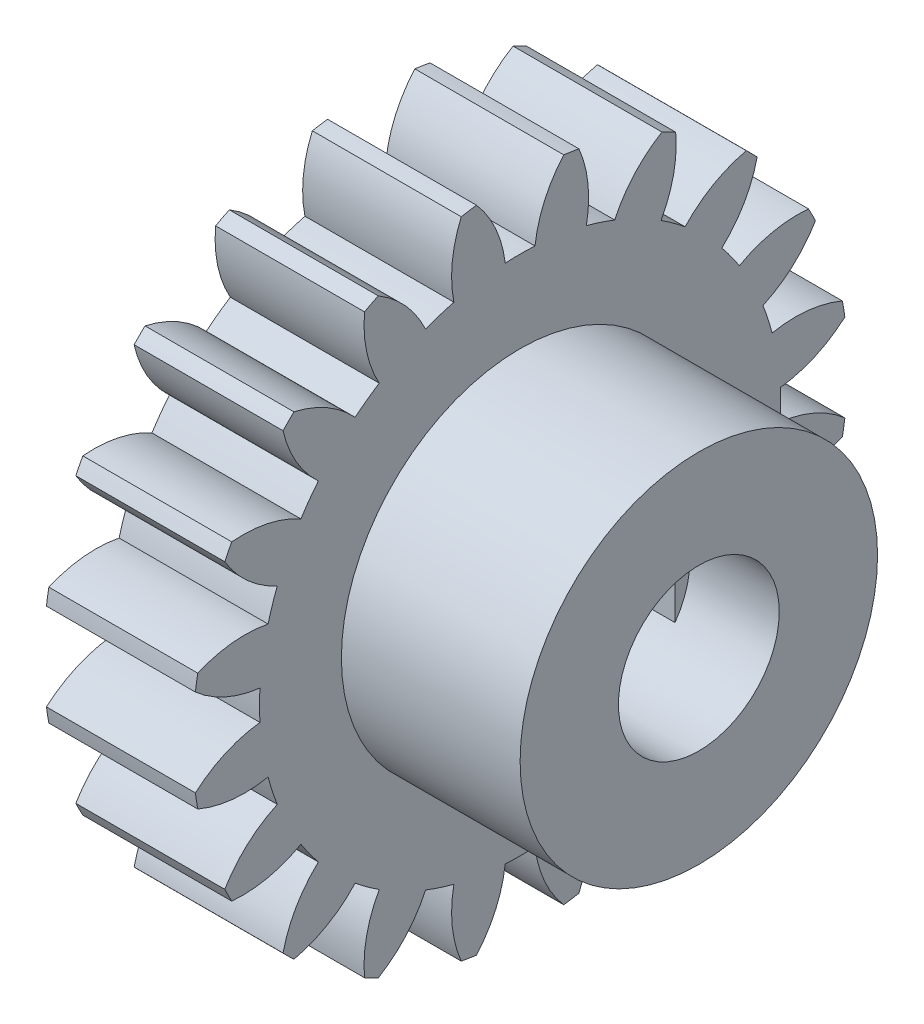
from build123d import *

# Parameters (mm, degrees)
BASPROSKE_W         = 5
BASPROSKE_H         = 11
TOOTHCUT_DEPTH      = 17.340134638
TEETHCUTS_COUNT     = 20
BORSKE_R            = 1.5
BORE_DEPTH          = 50.0000508
SKETCH_1_R          = 6
EXTRUDE_1_DEPTH     = 6
CUT_EXTRUDE_1_DEPTH = 14
SKETCH_3_R          = 2.7
CUT_EXTRUDE_2_DEPTH = 3


with BuildPart() as part:
    # BasProSke → Base-Revolve (revolve)
    with BuildSketch(Plane(origin=(0, 0, 0), x_dir=(1, 0, 0), z_dir=(0, 1, 0)), mode=Mode.PRIVATE) as base_revolve_sk:
        with Locations((2.5, 5.5)):
            Rectangle(BASPROSKE_W, BASPROSKE_H)
    revolve(base_revolve_sk.sketch.rotate(Axis((-10, 0, 0), (1, 0, 0)), 180), axis=Axis((-10, 0, 0), (1, 0, 0)))

    # TooCutSke → ToothCut (cut, through all)
    with BuildSketch(Plane(origin=(0, 0, 0), x_dir=(0, 0, -1), z_dir=(1, 0, 0))):
        with BuildLine():
            ThreePointArc((0.499924007, 8.734705318), (0, 8.749), (-0.499924007, 8.734705318))
            ThreePointArc((-0.499924007, 8.734705318), (-0.824302243, 9.905497836), (-1.485192705, 10.924909509))
            ThreePointArc((-1.485192705, 10.924909509), (0, 11.0254), (1.485192705, 10.924909509))
            ThreePointArc((1.485192705, 10.924909509), (0.824302243, 9.905497836), (0.499924007, 8.734705318))
        make_face()
    toothcut = extrude(amount=TOOTHCUT_DEPTH, mode=Mode.SUBTRACT)

    # TeethCuts: ToothCut ×20 about axis
    teethcuts_axis = Axis((0, 0, 0), (1, 0, 0))
    for i in range(1, TEETHCUTS_COUNT):
        add(toothcut.rotate(teethcuts_axis, i * 360 / TEETHCUTS_COUNT), mode=Mode.SUBTRACT)

    # BorSke → Bore (cut, symmetric)
    with BuildSketch(Plane(origin=(0, 0, 0), x_dir=(0, 0, -1), z_dir=(1, 0, 0))):
        with Locations(Location((0, 0, 0), (0, 0, 180))):
            Circle(BORSKE_R)
    extrude(amount=BORE_DEPTH, both=True, mode=Mode.SUBTRACT)

    # 草图1 → 凸台-拉伸1 (add)
    with BuildSketch(Plane(origin=(5, 0, 0), x_dir=(0, 0, -1), z_dir=(1, 0, 0))):
        with Locations(Location((0, 0, 0), (0, 0, 180))):
            Circle(SKETCH_1_R)
    extrude(amount=EXTRUDE_1_DEPTH)

    # 草图2 → 切除-拉伸1 (cut)
    with BuildSketch(Plane(origin=(11, 0, 0), x_dir=(0, 0, -1), z_dir=(1, 0, 0))):
        with BuildLine():
            Line((2.2, 1.565247584), (2.2, -1.565247584))
            ThreePointArc((2.2, -1.565247584), (-2.7, 0), (2.2, 1.565247584))
        make_face()
    extrude(amount=-CUT_EXTRUDE_1_DEPTH, mode=Mode.SUBTRACT)

    # 草图3 → 切除-拉伸2 (cut)
    with BuildSketch(Plane(origin=(11, 0, 0), x_dir=(0, 0, -1), z_dir=(1, 0, 0))):
        Circle(SKETCH_3_R)
    extrude(amount=-CUT_EXTRUDE_2_DEPTH, mode=Mode.SUBTRACT)


solid = part.part
